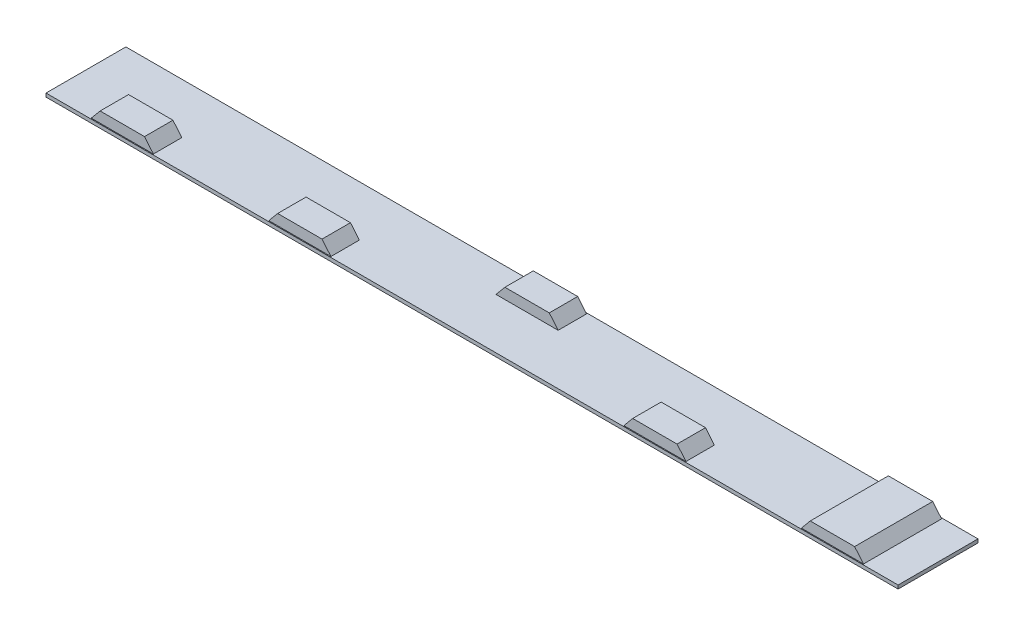
from build123d import *

# Parameters (mm, degrees)
SKETCH1_W                = 2400
SKETCH1_H                = 225
BOSS_EXTRUDE1_DEPTH      = 10
BOSS_EXTRUDE3_START      = 30
BOSS_EXTRUDE3_DEPTH      = 80
BOSS_EXTRUDE5_START      = 30
BOSS_EXTRUDE5_DEPTH      = 80
BOSS_EXTRUDE6_START      = -30
BOSS_EXTRUDE6_DEPTH      = 80
BOSS_EXTRUDE7_START      = 30
BOSS_EXTRUDE7_DEPTH      = 80
BOSS_EXTRUDE8_DEPTH      = 80
BOSS_EXTRUDE8_DEPTH_BACK = 140
BOSS_EXTRUDE8_START      = 30


with BuildPart() as part:
    # Sketch1 → Boss-Extrude1 (new body)
    with BuildSketch(Plane(origin=(0, 0, 0), x_dir=(1, 0, 0), z_dir=(0, 1, 0))):
        Rectangle(SKETCH1_W, SKETCH1_H)
    extrude(amount=BOSS_EXTRUDE1_DEPTH)

    # Sketch4 → Boss-Extrude3 (add)
    with BuildSketch(Plane.XY.offset(BOSS_EXTRUDE3_START)):
        Polygon((-1075, 10), (-900, 10), (-925, 40), (-1050, 40), align=None)
    extrude(amount=BOSS_EXTRUDE3_DEPTH)

    # Sketch6 → Boss-Extrude5 (add)
    with BuildSketch(Plane.XY.offset(BOSS_EXTRUDE5_START)):
        Polygon((-550, 40), (-575, 10), (-400, 10), (-425, 40), align=None)
    extrude(amount=BOSS_EXTRUDE5_DEPTH)

    # Sketch5 → Boss-Extrude6 (add)
    with BuildSketch(Plane.XY.offset(BOSS_EXTRUDE6_START)):
        Polygon((-75, 10), (100, 10), (75, 40), (-50, 40), align=None)
    extrude(amount=-BOSS_EXTRUDE6_DEPTH)

    # Sketch7 → Boss-Extrude7 (add)
    with BuildSketch(Plane.XY.offset(BOSS_EXTRUDE7_START)):
        Polygon((575, 40), (450, 40), (425, 10), (600, 10), align=None)
    extrude(amount=BOSS_EXTRUDE7_DEPTH)

    # Sketch8 → Boss-Extrude8 (add, two sides: drawn at the far end of the back side and taken through both)
    with BuildSketch(Plane.XY.offset(BOSS_EXTRUDE8_START - BOSS_EXTRUDE8_DEPTH_BACK)):
        Polygon((1075, 40), (950, 40), (925, 10), (1100, 10), align=None)
    extrude(amount=BOSS_EXTRUDE8_DEPTH + BOSS_EXTRUDE8_DEPTH_BACK)


solid = part.part
